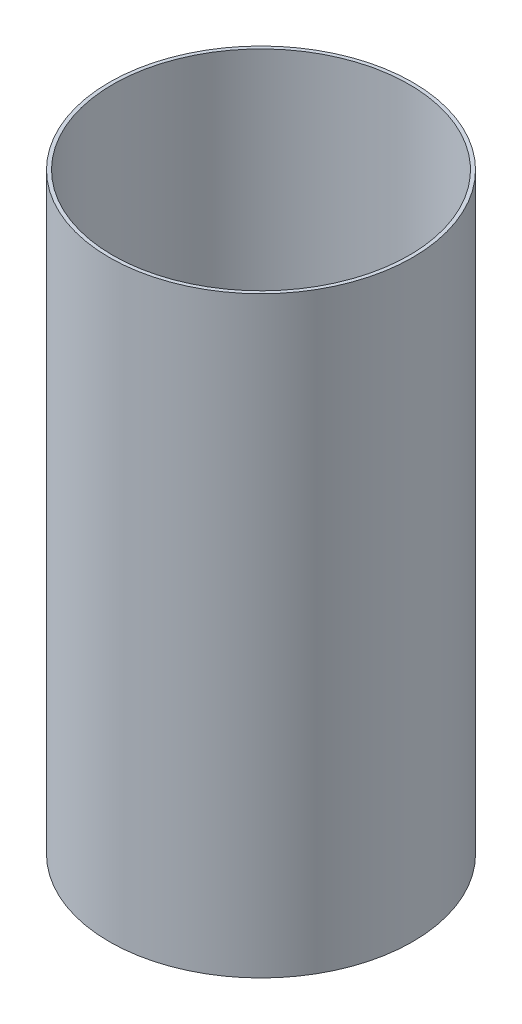
from build123d import *

# Parameters (mm, degrees)
SKETCH1_R           = 128
SKETCH1_R_2         = 125
BOSS_EXTRUDE1_DEPTH = 500


with BuildPart() as part:
    # Sketch1 → Boss-Extrude1 (new body)
    with BuildSketch(Plane(origin=(0, 0, 0), x_dir=(1, 0, 0), z_dir=(0, 1, 0))):
        with Locations(Location((0, 0, 0), (0, 0, 270))):
            Circle(SKETCH1_R)
        with Locations(Location((0, 0, 0), (0, 0, 270))):
            Circle(SKETCH1_R_2, mode=Mode.SUBTRACT)
    extrude(amount=BOSS_EXTRUDE1_DEPTH)


solid = part.part
